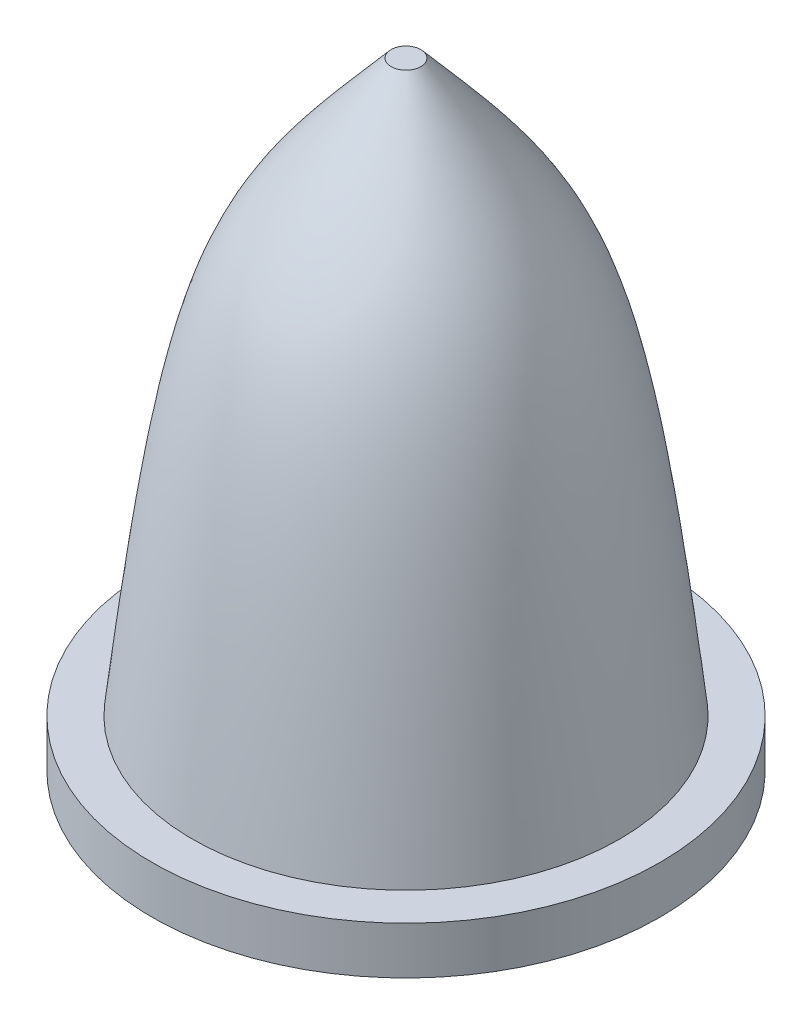
from build123d import *


with BuildPart() as part:
    # Sketch1 → Revolve1 (revolve)
    with BuildSketch(Plane.XY, mode=Mode.PRIVATE) as revolve1_sk:
        with BuildLine():
            Line((0, 3.262595757), (-2, 3.262595757))
            Line((-2, 3.262595757), (-2, 0))
            Line((-2, 0), (-5.35, 0))
            Line((-5.35, 0), (-5.35, 1))
            Line((-5.35, 1), (-4.5, 1))
            add(Edge.make_bspline(
                [(-4.5, 1), (-3.548013328, 9.462085204), (-3.131326696, 9.717205223), (-0.312384473, 13)],
                knots=[0, 0, 0, 0, 0.87332863, 0.87332863, 0.87332863, 0.87332863], degree=3))
            Line((-0.312384473, 13), (0, 13))
            Line((0, 13), (0, 3.262595757))
        make_face()
    revolve(revolve1_sk.sketch.rotate(Axis((0, -193.598068773, 0), (0, 1, 0)), 180), axis=Axis((0, -193.598068773, 0), (0, 1, 0)))


solid = part.part
